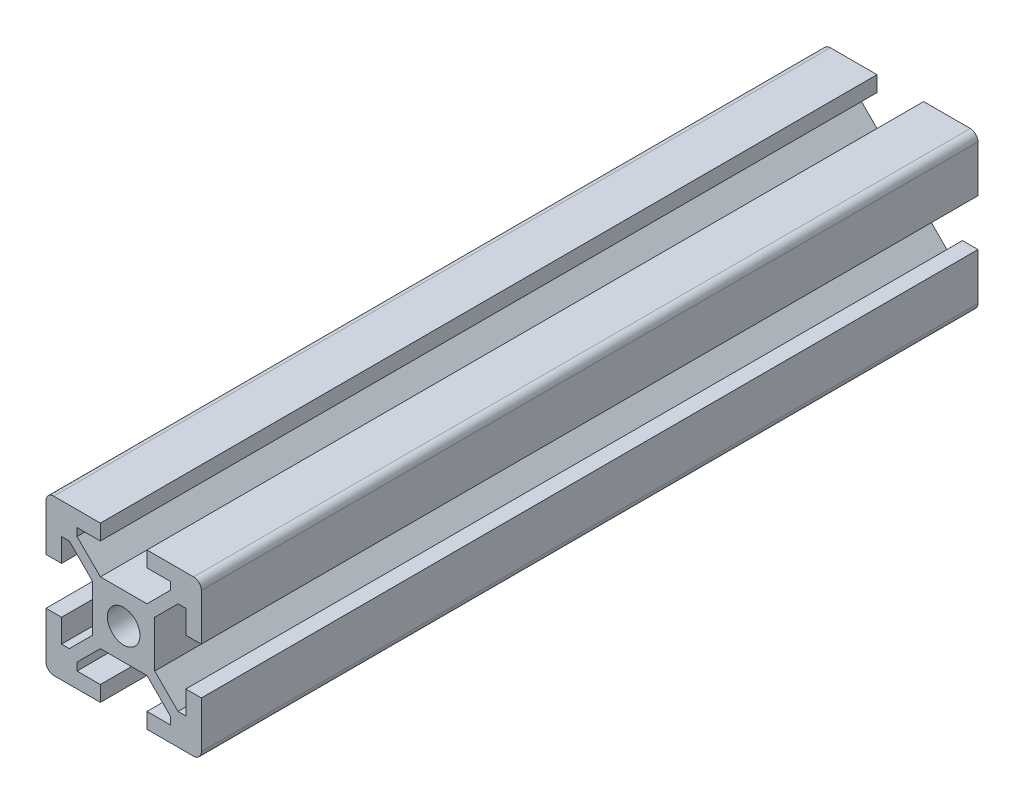
from build123d import *

# Parameters (mm, degrees)
SKETCH1_R           = 2.1
BOSS_EXTRUDE1_DEPTH = 100


with BuildPart() as part:
    # Sketch1 → Boss-Extrude1 (new body)
    with BuildSketch(Plane(origin=(0, 0, 0), x_dir=(-1, 0, 0), z_dir=(0, 0, -1))):
        with BuildLine():
            Line((6, -8), (3, -8))
            Line((3, -8), (3, -10))
            Line((3, -10), (9, -10))
            ThreePointArc((9, -10), (9.707106781, -9.707106781), (10, -9))
            Line((10, -9), (10, -3))
            Line((10, -3), (8, -3))
            Line((8, -3), (8, -6))
            Line((8, -6), (7, -6))
            Line((7, -6), (4, -3))
            Line((4, -3), (4, 3))
            Line((4, 3), (7, 6))
            Line((7, 6), (8, 6))
            Line((8, 6), (8, 3))
            Line((8, 3), (10, 3))
            Line((10, 3), (10, 9))
            ThreePointArc((10, 9), (9.707106781, 9.707106781), (9, 10))
            Line((9, 10), (3, 10))
            Line((3, 10), (3, 8))
            Line((3, 8), (6, 8))
            Line((6, 8), (6, 7))
            Line((6, 7), (3, 4))
            Line((3, 4), (-3, 4))
            Line((-3, 4), (-6, 7))
            Line((-6, 7), (-6, 8))
            Line((-6, 8), (-3, 8))
            Line((-3, 8), (-3, 10))
            Line((-3, 10), (-9, 10))
            ThreePointArc((-9, 10), (-9.707106781, 9.707106781), (-10, 9))
            Line((-10, 9), (-10, 3))
            Line((-10, 3), (-8, 3))
            Line((-8, 3), (-8, 6))
            Line((-8, 6), (-7, 6))
            Line((-7, 6), (-4, 3))
            Line((-4, 3), (-4, -3))
            Line((-4, -3), (-7, -6))
            Line((-7, -6), (-8, -6))
            Line((-8, -6), (-8, -3))
            Line((-8, -3), (-10, -3))
            Line((-10, -3), (-10, -9))
            ThreePointArc((-10, -9), (-9.707106781, -9.707106781), (-9, -10))
            Line((-9, -10), (-3, -10))
            Line((-3, -10), (-3, -8))
            Line((-3, -8), (-6, -8))
            Line((-6, -8), (-6, -7))
            Line((-6, -7), (-3, -4))
            Line((-3, -4), (3, -4))
            Line((3, -4), (6, -7))
            Line((6, -7), (6, -8))
        make_face()
        with Locations(Location((0, 0, 0), (0, 0, 180))):
            Circle(SKETCH1_R, mode=Mode.SUBTRACT)
    extrude(amount=-BOSS_EXTRUDE1_DEPTH)


solid = part.part
